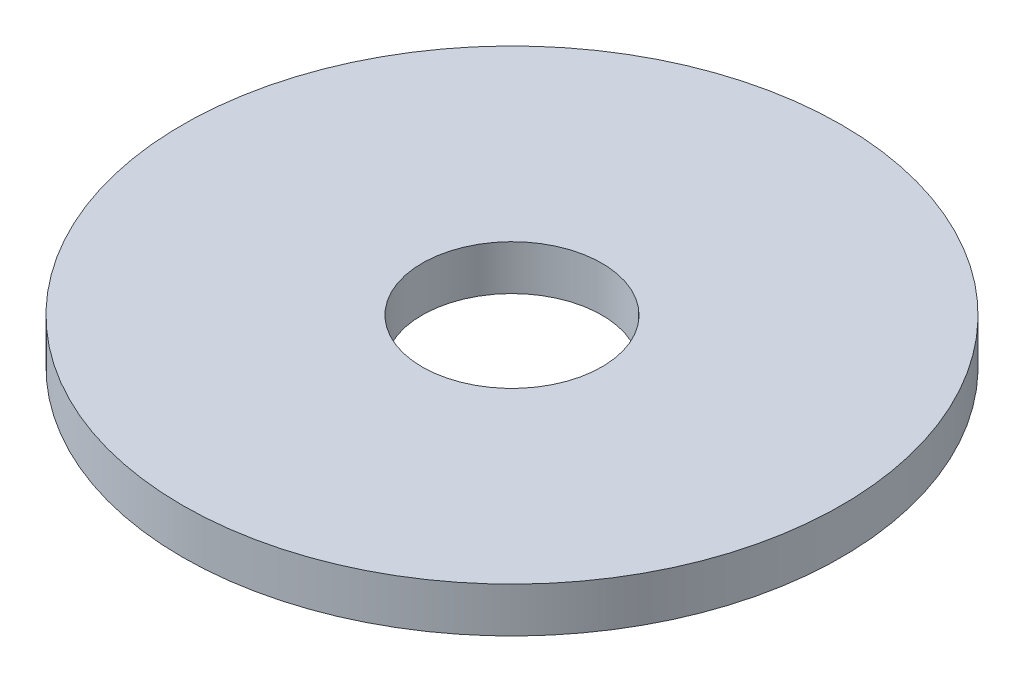
from build123d import *

# Parameters (mm, degrees)
SKETCH1_R           = 11
SKETCH1_R_2         = 3
BOSS_EXTRUDE1_DEPTH = 1.5


with BuildPart() as part:
    # Sketch1 → Boss-Extrude1 (new body)
    with BuildSketch(Plane(origin=(0, 0, 0), x_dir=(1, 0, 0), z_dir=(0, 1, 0))):
        with Locations(Location((0, 0, 0), (0, 0, 270))):
            Circle(SKETCH1_R)
        with Locations(Location((0, 0, 0), (0, 0, 270))):
            Circle(SKETCH1_R_2, mode=Mode.SUBTRACT)
    extrude(amount=BOSS_EXTRUDE1_DEPTH)


solid = part.part
